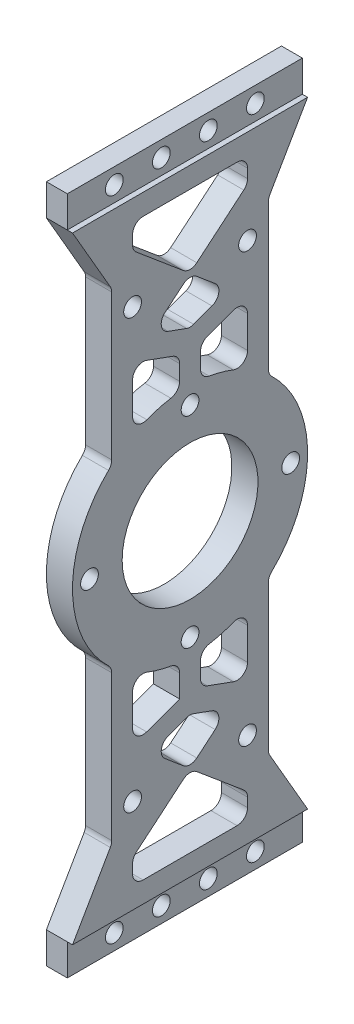
from build123d import *

# Parameters (mm, degrees)
SKETCH_1_W          = 5
SKETCH_1_H          = 30
EXTRUDE_1_DEPTH     = 130
SKETCH_2_R          = 22.5
EXTRUDE_2_DEPTH     = 5
SKETCH_3_R          = 13
CUT_EXTRUDE_1_DEPTH = 136.392946641
HOLE_WIZARD_M33_D   = 3.4
HOLE_WIZARD_M32_D   = 3.4
EXTRUDE_3_DEPTH     = 5
HOLE_WIZARD_M31_D   = 3.4
SKETCH_14_W         = 45
SKETCH_14_H         = 6
CUT_EXTRUDE_2_DEPTH = 1
CUT_EXTRUDE_3_REACH = 137.393
FILLET_1_R          = 2
FILLET_2_R          = 2


with BuildPart() as part:
    # Эскиз1 → Бобышка-Вытянуть1 (new body)
    with BuildSketch(Plane(origin=(0, 0, 0), x_dir=(1, 0, 0), z_dir=(0, 1, 0))):
        with Locations((2.5, -15)):
            Rectangle(SKETCH_1_W, SKETCH_1_H)
    extrude(amount=EXTRUDE_1_DEPTH)

    # Эскиз2 → Бобышка-Вытянуть2 (add)
    with BuildSketch(Plane.ZY):
        with Locations((15, 65)):
            Circle(SKETCH_2_R)
    extrude(amount=-EXTRUDE_2_DEPTH)

    # Эскиз3 → Вырез-Вытянуть1 (cut, through all)
    with BuildSketch(Plane.ZY):
        with Locations((15, 65)):
            Circle(SKETCH_3_R)
    extrude(amount=-CUT_EXTRUDE_1_DEPTH, mode=Mode.SUBTRACT)

    # Отверстие с зазором M33 (through all)
    with Locations(Plane(origin=(5, -25.024735225, 7.262908886), x_dir=(0, 0, 1), z_dir=(1, 0, 0))):
        with Locations((7.737091114, -109.274735225), (-11.512908886, -90.024735225), (7.737091114, -70.774735225), (26.987091114, -90.024735225)):
            Hole(HOLE_WIZARD_M33_D / 2)

    # Отверстие с зазором M32 (through all)
    with Locations(Plane(origin=(5, 0, 0), x_dir=(0, 0, -1), z_dir=(1, 0, 0))):
        with Locations((-26, 106), (-4, 106), (-4, 24), (-26, 24)):
            Hole(HOLE_WIZARD_M32_D / 2)

    # Эскиз11 → Бобышка-Вытянуть3 (add)
    with BuildSketch(Plane(origin=(5, 0, 0), x_dir=(0, 0, -1), z_dir=(1, 0, 0))):
        Polygon((-37.5, 124), (-30, 111.009618943), (0, 111.009618943), (7.5, 124), (7.5, 130), (-37.5, 130), align=None)
        Polygon((0, 18.990381057), (7.5, 6), (7.5, 0), (-37.5, 0), (-37.5, 6), (-30, 18.990381057), align=None)
    extrude(amount=-EXTRUDE_3_DEPTH)

    # Отверстие с зазором M31 (through all)
    with Locations(Plane(origin=(5, 0, 0), x_dir=(0, 0, -1), z_dir=(1, 0, 0))):
        with Locations((-28.5, 127), (-19.5, 127), (-10.5, 127), (-1.5, 127), (-28.5, 3), (-19.5, 3), (-10.5, 3), (-1.5, 3)):
            Hole(HOLE_WIZARD_M31_D / 2)

    # Эскиз14 → Вырез-Вытянуть2 (cut)
    with BuildSketch(Plane(origin=(5, 0, 0), x_dir=(0, 0, -1), z_dir=(1, 0, 0))):
        with Locations((-15, 127)):
            Rectangle(SKETCH_14_W, SKETCH_14_H)
        with Locations((-15, 3)):
            Rectangle(SKETCH_14_W, SKETCH_14_H)
    extrude(amount=-CUT_EXTRUDE_2_DEPTH, mode=Mode.SUBTRACT)

    # Эскиз15 → Вырез-Вытянуть3 (cut, up to next)
    with BuildSketch(Plane(origin=(5, 0, 0), x_dir=(0, 0, -1), z_dir=(1, 0, 0)), mode=Mode.PRIVATE) as cut_extrude_3_sk1:
        with BuildLine():
            Line((-17, 42.589065169), (-17, 36.505828051))
            Line((-17, 36.505828051), (-26, 33.230095943))
            Line((-26, 33.230095943), (-26, 45.372213574))
            ThreePointArc((-26, 45.372213574), (-21.647291084, 43.504337153), (-17, 42.589065169))
        make_face()
    cut_extrude_3_tool1 = extrude(cut_extrude_3_sk1.sketch, amount=-CUT_EXTRUDE_3_REACH, mode=Mode.PRIVATE) & part.part
    # Эскиз15 → Вырез-Вытянуть3 (cut, up to next)
    with BuildSketch(Plane(origin=(5, 0, 0), x_dir=(0, 0, -1), z_dir=(1, 0, 0)), mode=Mode.PRIVATE) as cut_extrude_3_sk2:
        with BuildLine():
            Line((-13, 42.589065169), (-13, 36.505828051))
            Line((-13, 36.505828051), (-4, 33.230095943))
            Line((-4, 33.230095943), (-4, 45.372213574))
            ThreePointArc((-4, 45.372213574), (-8.352708916, 43.504337153), (-13, 42.589065169))
        make_face()
    cut_extrude_3_tool2 = extrude(cut_extrude_3_sk2.sketch, amount=-CUT_EXTRUDE_3_REACH, mode=Mode.PRIVATE) & part.part
    # Эскиз15 → Вырез-Вытянуть3 (cut, up to next)
    with BuildSketch(Plane(origin=(5, 0, 0), x_dir=(0, 0, -1), z_dir=(1, 0, 0)), mode=Mode.PRIVATE) as cut_extrude_3_sk3:
        Polygon((-15, 32.97705743), (-22.461792276, 30.261187147), (-15, 24), (-7.538207724, 30.261187147), align=None)
    cut_extrude_3_tool3 = extrude(cut_extrude_3_sk3.sketch, amount=-CUT_EXTRUDE_3_REACH, mode=Mode.PRIVATE) & part.part
    # Эскиз15 → Вырез-Вытянуть3 (cut, up to next)
    with BuildSketch(Plane(origin=(5, 0, 0), x_dir=(0, 0, -1), z_dir=(1, 0, 0)), mode=Mode.PRIVATE) as cut_extrude_3_sk4:
        Polygon((-15, 23.9), (-26, 14.669904057), (-26, 10), (-4, 10), (-4, 14.669904057), align=None)
    cut_extrude_3_tool4 = extrude(cut_extrude_3_sk4.sketch, amount=-CUT_EXTRUDE_3_REACH, mode=Mode.PRIVATE) & part.part
    # Эскиз15 → Вырез-Вытянуть3 (cut, up to next)
    with BuildSketch(Plane(origin=(5, 0, 0), x_dir=(0, 0, -1), z_dir=(1, 0, 0)), mode=Mode.PRIVATE) as cut_extrude_3_sk5:
        with BuildLine():
            Line((-13, 87.410934831), (-13, 93.494171949))
            Line((-13, 93.494171949), (-4, 96.769904057))
            Line((-4, 96.769904057), (-4, 84.627786426))
            ThreePointArc((-4, 84.627786426), (-8.352708916, 86.495662847), (-13, 87.410934831))
        make_face()
    cut_extrude_3_tool5 = extrude(cut_extrude_3_sk5.sketch, amount=-CUT_EXTRUDE_3_REACH, mode=Mode.PRIVATE) & part.part
    # Эскиз15 → Вырез-Вытянуть3 (cut, up to next)
    with BuildSketch(Plane(origin=(5, 0, 0), x_dir=(0, 0, -1), z_dir=(1, 0, 0)), mode=Mode.PRIVATE) as cut_extrude_3_sk6:
        with BuildLine():
            Line((-26, 96.769904057), (-26, 84.627786426))
            ThreePointArc((-26, 84.627786426), (-21.647291084, 86.495662847), (-17, 87.410934831))
            Line((-17, 87.410934831), (-17, 93.494171949))
            Line((-17, 93.494171949), (-26, 96.769904057))
        make_face()
    cut_extrude_3_tool6 = extrude(cut_extrude_3_sk6.sketch, amount=-CUT_EXTRUDE_3_REACH, mode=Mode.PRIVATE) & part.part
    # Эскиз15 → Вырез-Вытянуть3 (cut, up to next)
    with BuildSketch(Plane(origin=(5, 0, 0), x_dir=(0, 0, -1), z_dir=(1, 0, 0)), mode=Mode.PRIVATE) as cut_extrude_3_sk7:
        Polygon((-7.538207724, 99.738812853), (-15, 97.02294257), (-22.461792276, 99.738812853), (-15, 106), align=None)
    cut_extrude_3_tool7 = extrude(cut_extrude_3_sk7.sketch, amount=-CUT_EXTRUDE_3_REACH, mode=Mode.PRIVATE) & part.part
    # Эскиз15 → Вырез-Вытянуть3 (cut, up to next)
    with BuildSketch(Plane(origin=(5, 0, 0), x_dir=(0, 0, -1), z_dir=(1, 0, 0)), mode=Mode.PRIVATE) as cut_extrude_3_sk8:
        Polygon((-4, 120), (-4, 115.330095943), (-15, 106.1), (-26, 115.330095943), (-26, 120), align=None)
    cut_extrude_3_tool8 = extrude(cut_extrude_3_sk8.sketch, amount=-CUT_EXTRUDE_3_REACH, mode=Mode.PRIVATE) & part.part
    add(cut_extrude_3_tool1.solids().sort_by_distance((5, 39.236423, 22.016157))[0], mode=Mode.SUBTRACT)
    add(cut_extrude_3_tool2.solids().sort_by_distance((5, 39.236423, 7.983843))[0], mode=Mode.SUBTRACT)
    add(cut_extrude_3_tool3.solids().sort_by_distance((5, 29.079415, 15))[0], mode=Mode.SUBTRACT)
    add(cut_extrude_3_tool4.solids().sort_by_distance((5, 15.024791, 15))[0], mode=Mode.SUBTRACT)
    add(cut_extrude_3_tool5.solids().sort_by_distance((5, 90.763577, 7.983843))[0], mode=Mode.SUBTRACT)
    add(cut_extrude_3_tool6.solids().sort_by_distance((5, 90.763577, 22.016157))[0], mode=Mode.SUBTRACT)
    add(cut_extrude_3_tool7.solids().sort_by_distance((5, 100.920585, 15))[0], mode=Mode.SUBTRACT)
    add(cut_extrude_3_tool8.solids().sort_by_distance((5, 114.975209, 15))[0], mode=Mode.SUBTRACT)

    # Скругление1
    fillet_1_edges = [part.edges().sort_by_distance(p)[0] for p in [
        (2.5, 18.990381057, 30),
        (2.5, 18.990381057, 0),
        (2.5, 48.229490169, 0),
        (2.5, 81.770509831, 0),
        (2.5, 48.229490169, 30),
        (2.5, 81.770509831, 30),
        (2.5, 111.009618943, 0),
        (2.5, 111.009618943, 30),
    ]]
    fillet(fillet_1_edges, radius=FILLET_1_R)

    # Скругление2
    fillet_2_edges = [part.edges().sort_by_distance(p)[0] for p in [
        (2.5, 45.372213574, 26),
        (2.5, 42.589065169, 17),
        (2.5, 33.230095943, 26),
        (2.5, 42.589065169, 13),
        (2.5, 45.372213574, 4),
        (2.5, 33.230095943, 4),
        (2.5, 36.505828051, 13),
        (2.5, 32.97705743, 15),
        (2.5, 30.261187147, 7.538207724),
        (2.5, 24, 15),
        (2.5, 30.261187147, 22.461792276),
        (2.5, 23.9, 15),
        (2.5, 14.669904057, 4),
        (2.5, 10, 4),
        (2.5, 10, 26),
        (2.5, 14.669904057, 26),
        (2.5, 84.627786426, 4),
        (2.5, 87.410934831, 13),
        (2.5, 93.494171949, 13),
        (2.5, 96.769904057, 4),
        (2.5, 87.410934831, 17),
        (2.5, 84.627786426, 26),
        (2.5, 96.769904057, 26),
        (2.5, 93.494171949, 17),
        (2.5, 106, 15),
        (2.5, 99.738812853, 7.538207724),
        (2.5, 97.02294257, 15),
        (2.5, 99.738812853, 22.461792276),
        (2.5, 120, 26),
        (2.5, 120, 4),
        (2.5, 115.330095943, 4),
        (2.5, 106.1, 15),
        (2.5, 115.330095943, 26),
    ]]
    fillet(fillet_2_edges, radius=FILLET_2_R)


solid = part.part
